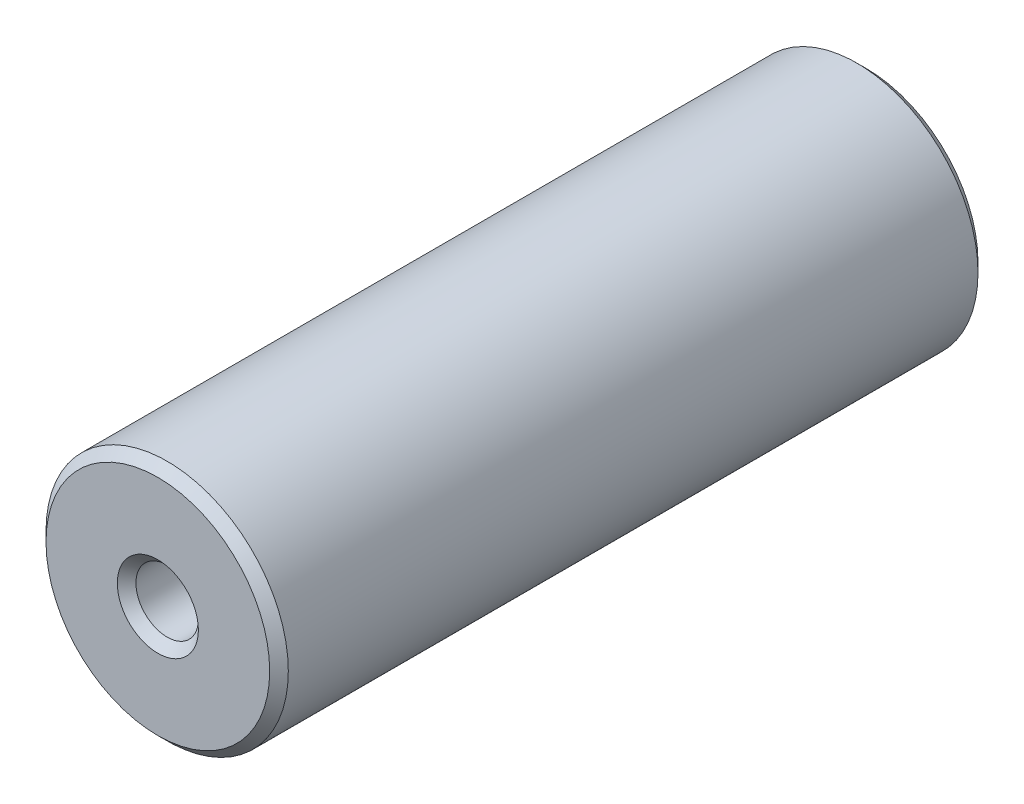
from build123d import *

# Parameters (mm, degrees)
ESQUISSE1_R        = 13
ESQUISSE1_R_2      = 3.35
BOSS_EXTRU_1_DEPTH = 76
CHANFREIN1_SIZE    = 1


with BuildPart() as part:
    # Esquisse1 → Boss.-Extru.1 (new body)
    with BuildSketch(Plane.XY):
        Circle(ESQUISSE1_R)
        Circle(ESQUISSE1_R_2, mode=Mode.SUBTRACT)
    extrude(amount=BOSS_EXTRU_1_DEPTH)

    # Chanfrein1
    chanfrein1_edges = [part.edges().sort_by_distance(p)[0] for p in [
        (-13, 0, 0),
        (-13, 0, 76),
        (-3.35, 0, 0),
        (-3.35, 0, 76),
    ]]
    chamfer(chanfrein1_edges, length=CHANFREIN1_SIZE)


solid = part.part
